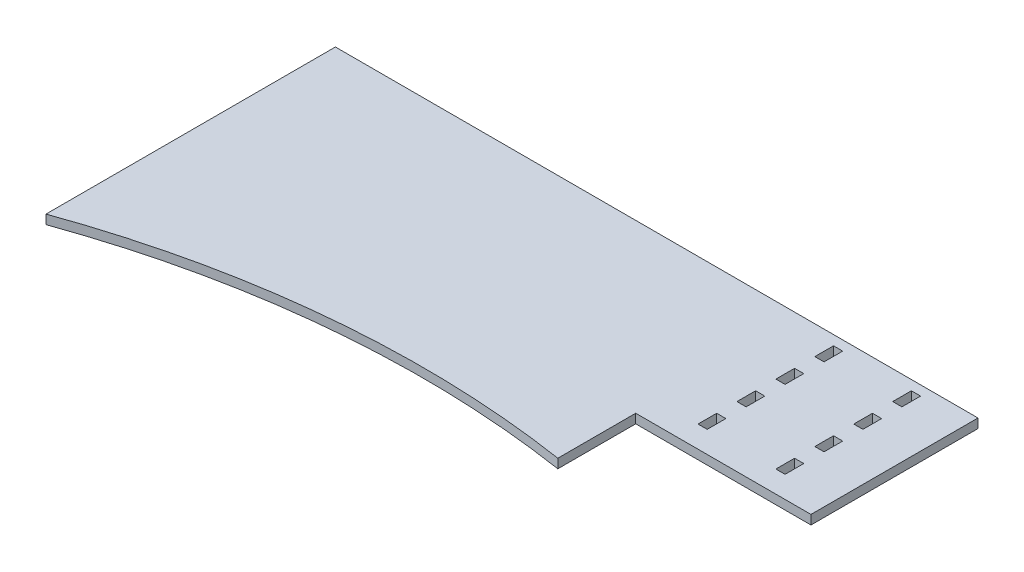
from build123d import *

# Parameters (mm, degrees)
SKETCH1_W               = 209.55
SKETCH1_H               = 101.6
BOSS_EXTRUDE1_DEPTH     = 1.5
CUT_EXTRUDE1_DEPTH      = 117.479357077
CUT_EXTRUDE1_DEPTH_BACK = 117.479357077
SKETCH2_R               = 311.15
CUT_EXTRUDE2_DEPTH      = 117.479357077
CUT_EXTRUDE2_DEPTH_BACK = 117.479357077
CUT_EXTRUDE3_DEPTH      = 117.479357077
CUT_EXTRUDE3_DEPTH_BACK = 117.479357077
SKETCH5_W               = 3
SKETCH5_H               = 6.096


with BuildPart() as part:
    # Sketch1 → Boss-Extrude1 (new, symmetric)
    with BuildSketch(Plane(origin=(0, 0, 0), x_dir=(1, 0, 0), z_dir=(0, 1, 0))):
        Rectangle(SKETCH1_W, SKETCH1_H)
    extrude(amount=BOSS_EXTRUDE1_DEPTH, both=True)

    # Sketch2 → Cut-Extrude1 (cut, two sides: drawn at the far end of the back side and taken through both)
    with BuildSketch(Plane(origin=(0, 1.5, 0), x_dir=(1, 0, 0), z_dir=(0, 1, 0)).offset(-CUT_EXTRUDE1_DEPTH_BACK)):
        with Locations((0, -336.55)):
            Circle(SKETCH2_R)
    extrude(amount=CUT_EXTRUDE1_DEPTH + CUT_EXTRUDE1_DEPTH_BACK, mode=Mode.SUBTRACT)

    # Sketch4 → Cut-Extrude2 (cut, two sides: drawn at the far end of the back side and taken through both)
    with BuildSketch(Plane(origin=(0, 1.5, 0), x_dir=(1, 0, 0), z_dir=(0, 1, 0)).offset(-CUT_EXTRUDE2_DEPTH_BACK)):
        Polygon((47.625, -29.066371371), (47.625, -3.666371371), (104.775, -3.666371371), (104.775, -43.571294502), align=None)
    extrude(amount=CUT_EXTRUDE2_DEPTH + CUT_EXTRUDE2_DEPTH_BACK, mode=Mode.SUBTRACT)

    # Sketch5 → Cut-Extrude3 (cut, two sides: drawn at the far end of the back side and taken through both)
    with BuildSketch(Plane(origin=(0, 1.5, 0), x_dir=(1, 0, 0), z_dir=(0, 1, 0)).offset(-CUT_EXTRUDE3_DEPTH_BACK)):
        with Locations((87.733, 44.577)):
            Rectangle(SKETCH5_W, SKETCH5_H)
        with Locations((87.733, 31.877)):
            Rectangle(SKETCH5_W, SKETCH5_H)
        with Locations((87.733, 19.177)):
            Rectangle(SKETCH5_W, SKETCH5_H)
        with Locations((87.733, 6.477)):
            Rectangle(SKETCH5_W, SKETCH5_H)
        with Locations((62.333, 31.877)):
            Rectangle(SKETCH5_W, SKETCH5_H)
        with Locations((62.333, 19.177)):
            Rectangle(SKETCH5_W, SKETCH5_H)
        with Locations((62.333, 6.477)):
            Rectangle(SKETCH5_W, SKETCH5_H)
        with Locations((62.333, 44.577)):
            Rectangle(SKETCH5_W, SKETCH5_H)
    extrude(amount=CUT_EXTRUDE3_DEPTH + CUT_EXTRUDE3_DEPTH_BACK, mode=Mode.SUBTRACT)


solid = part.part
